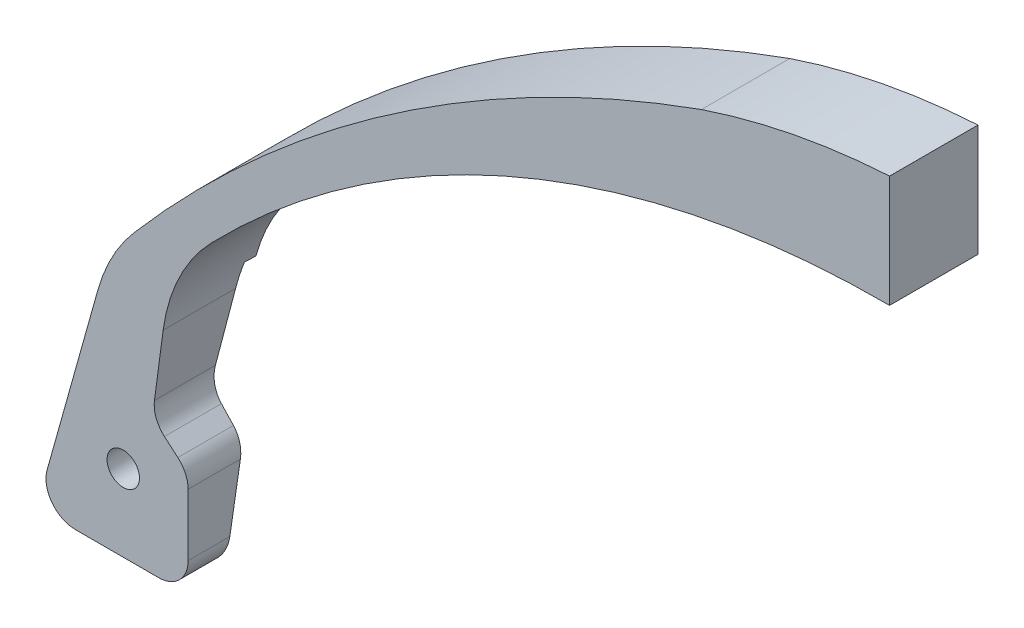
from build123d import *

# Parameters (mm, degrees)
ESQUISSE2_R             = 2.75
BOSS_EXTRU_1_DEPTH      = 15
ENL_V_MAT_EXTRU_1_DEPTH = 36
CONG_1_R                = 30
CONG_2_R                = 30
CONG_3_R                = 5
CONG_4_R                = 5
CONG_5_R                = 5
CONG_6_R                = 5


with BuildPart() as part:
    # Esquisse2 → Boss.-Extru.1 (new body)
    with BuildSketch(Plane.XY):
        with BuildLine():
            Line((-125.064319956, 10), (-122, 33))
            ThreePointArc((-122, 33), (-67.197277761, 74.501212265), (0, 89))
            Line((0, 89), (0, 108))
            ThreePointArc((0, 108), (-16.165722488, 105.975834437), (-31.918403878, 101.818809198))
            ThreePointArc((-31.918403878, 101.818809198), (-87.157005326, 72.996548183), (-132.564319956, 30.332727469))
            Line((-132.564319956, 30.332727469), (-144.7, -13))
            Line((-144.7, -13), (-119, -13))
            Line((-119, -13), (-119, 4.782335439))
            Line((-119, 4.782335439), (-125.064319956, 10))
        make_face()
        with Locations((-130, 0)):
            Circle(ESQUISSE2_R, mode=Mode.SUBTRACT)
    extrude(amount=BOSS_EXTRU_1_DEPTH)

    # Esquisse5 → Enlèv. mat.-Extru.1 (cut)
    with BuildSketch(Plane(origin=(-130.800251379, 36.631666021, 0), x_dir=(0, 0, 1), z_dir=(-0.9629494993021883, 0.2696817787572327, 0))):
        Polygon((0, -51.541296877), (10, -51.541296877), (2, -6.418445839), (0, -6.541296877), align=None)
    extrude(amount=-ENL_V_MAT_EXTRU_1_DEPTH, mode=Mode.SUBTRACT)

    # Congé1
    cong_1_edges = [part.edges().sort_by_distance(p)[0] for p in [
        (-132.564319956, 30.332727469, 8.510890361),
    ]]
    fillet(cong_1_edges, radius=CONG_1_R)

    # Congé2
    cong_2_edges = [part.edges().sort_by_distance(p)[0] for p in [
        (-122, 33, 7.5),
    ]]
    fillet(cong_2_edges, radius=CONG_2_R)

    # Congé3
    cong_3_edges = [part.edges().sort_by_distance(p)[0] for p in [
        (-125.064319956, 10, 10.067243827),
    ]]
    fillet(cong_3_edges, radius=CONG_3_R)

    # Congé4
    cong_4_edges = [part.edges().sort_by_distance(p)[0] for p in [
        (-119, 4.782335439, 10.367660206),
    ]]
    fillet(cong_4_edges, radius=CONG_4_R)

    # Congé5
    cong_5_edges = [part.edges().sort_by_distance(p)[0] for p in [
        (-119, -13, 11.885604273),
    ]]
    fillet(cong_5_edges, radius=CONG_5_R)

    # Congé6
    cong_6_edges = [part.edges().sort_by_distance(p)[0] for p in [
        (-144.7, -13, 12.5),
    ]]
    fillet(cong_6_edges, radius=CONG_6_R)


solid = part.part
